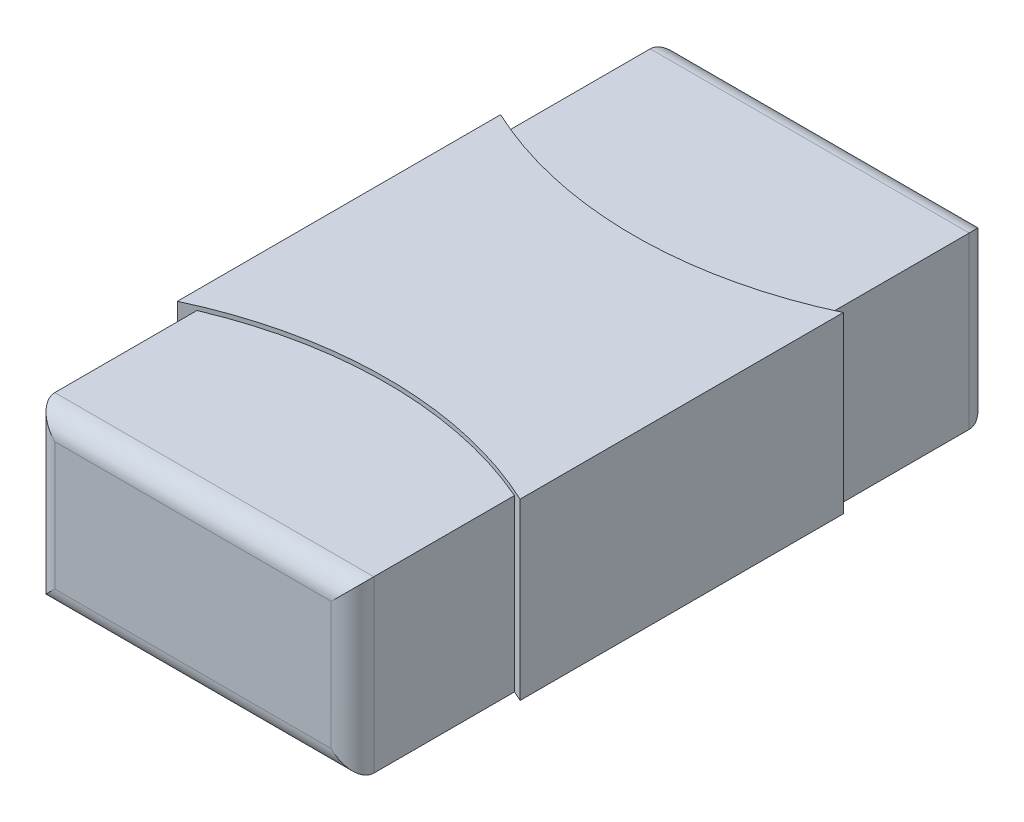
from build123d import *

# Parameters (mm, degrees)
ESQUISSE1_W             = 1.5
ESQUISSE1_H             = 3
BOSS_EXTRU_1_DEPTH      = 0.8
CONG_1_R                = 0.1
BOSS_EXTRU_2_DEPTH      = 0.02
BOSS_EXTRU_2_DEPTH_BACK = 0.8


with BuildPart() as part:
    # Esquisse1 → Boss.-Extru.1 (new body)
    with BuildSketch(Plane(origin=(0, 0, 0), x_dir=(1, 0, 0), z_dir=(0, 1, 0))):
        Rectangle(ESQUISSE1_W, ESQUISSE1_H)
    extrude(amount=BOSS_EXTRU_1_DEPTH)

    # Congé1
    cong_1_edges = [part.edges().sort_by_distance(p)[0] for p in [
        (0, 0.8, -1.5),
        (0, 0, -1.5),
        (0, 0, 1.5),
        (0, 0.8, 1.5),
        (-0.75, 0.4, -1.5),
        (0.75, 0.4, -1.5),
        (0.75, 0.4, 1.5),
        (-0.75, 0.4, 1.5),
    ]]
    fillet(cong_1_edges, radius=CONG_1_R)

    # Esquisse2 → Boss.-Extru.2 (add, two sides: drawn at the far end of the back side and taken through both)
    with BuildSketch(Plane(origin=(0, 0.8, 0), x_dir=(1, 0, 0), z_dir=(0, 1, 0)).offset(-BOSS_EXTRU_2_DEPTH_BACK)):
        with BuildLine():
            Line((-0.813673936, -0.759907702), (-0.813673936, 0.759907702))
            ThreePointArc((-0.813673936, 0.759907702), (-0.007860433, 0.580975839), (0.797952705, 0.759909342))
            Line((0.797952705, 0.759909342), (0.797952705, -0.759909342))
            ThreePointArc((0.797952705, -0.759909342), (-0.007860433, -0.580975839), (-0.813673936, -0.759907702))
        make_face()
    extrude(amount=BOSS_EXTRU_2_DEPTH + BOSS_EXTRU_2_DEPTH_BACK)


solid = part.part
